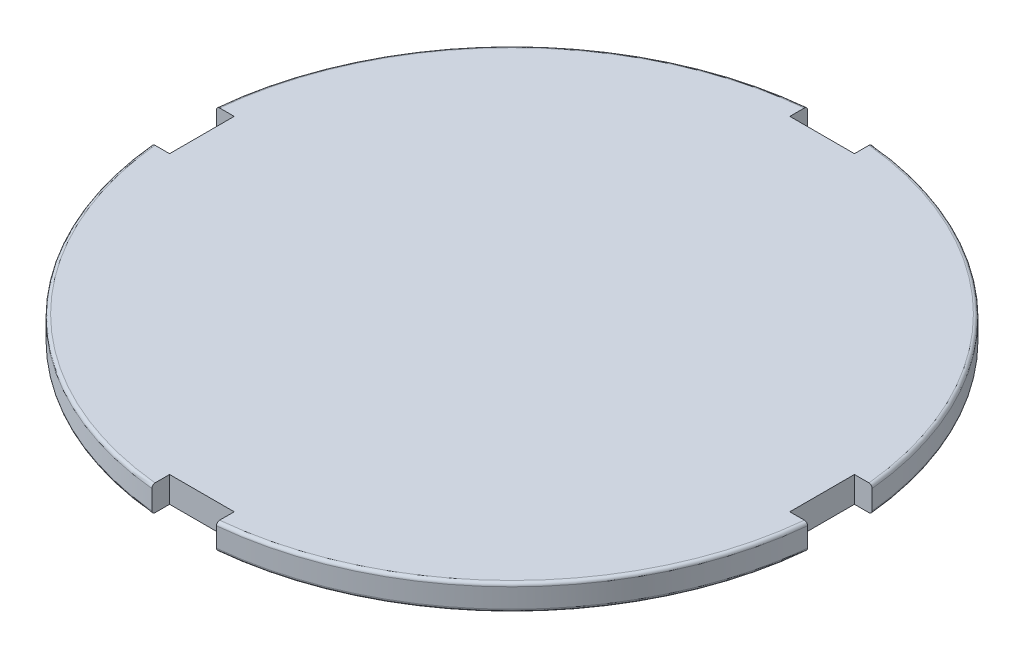
from build123d import *

# Parameters (mm, degrees)
SKETCH2_R           = 64.77
BOSS_EXTRUDE1_DEPTH = 5.08
FILLET1_R           = 0.635
SKETCH3_W           = 12.7
SKETCH3_H           = 15.225369524
SKETCH3_W_2         = 15.225369524
SKETCH3_H_2         = 12.7
CUT_EXTRUDE1_DEPTH  = 92.739371117


with BuildPart() as part:
    # Sketch2 → Boss-Extrude1 (new body)
    with BuildSketch(Plane(origin=(0, 0, 0), x_dir=(1, 0, 0), z_dir=(0, 1, 0))):
        with Locations(Location((0, 0, 0), (0, 0, 270))):
            Circle(SKETCH2_R)
    extrude(amount=BOSS_EXTRUDE1_DEPTH)

    # Fillet1
    fillet1_edges = [part.edges().sort_by_distance(p)[0] for p in [
        (0, 0, -64.77),
        (0, 5.08, -64.77),
    ]]
    fillet(fillet1_edges, radius=FILLET1_R)

    # Sketch3 → Cut-Extrude1 (cut, through all)
    with BuildSketch(Plane.XZ):
        with Locations((0, 68.572684762)):
            Rectangle(SKETCH3_W, SKETCH3_H)
        with Locations((68.572684762, 0)):
            Rectangle(SKETCH3_W_2, SKETCH3_H_2)
        with Locations((0, -68.572684762)):
            Rectangle(SKETCH3_W, SKETCH3_H)
        with Locations((-68.572684762, 0)):
            Rectangle(SKETCH3_W_2, SKETCH3_H_2)
    extrude(amount=-CUT_EXTRUDE1_DEPTH, mode=Mode.SUBTRACT)


solid = part.part
